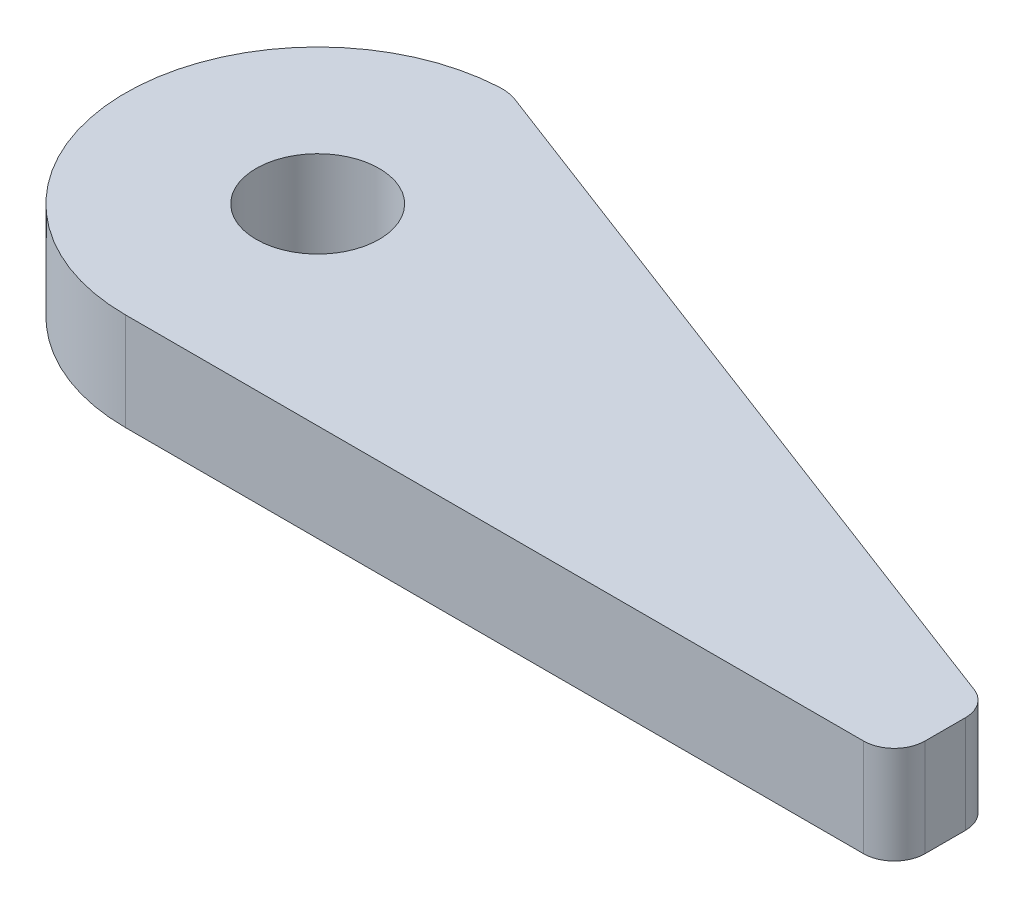
from build123d import *

# Parameters (mm, degrees)
SKETCH1_R           = 4
BOSS_EXTRUDE1_DEPTH = 6.35
FILLET1_R           = 2
FILLET2_R           = 3


with BuildPart() as part:
    # Sketch1 → Boss-Extrude1 (new body)
    with BuildSketch(Plane(origin=(0, 0, 0), x_dir=(1, 0, 0), z_dir=(0, 1, 0))):
        with BuildLine():
            Line((0, -12.5), (50, -12.5))
            Line((50, -12.5), (50, -6.5))
            Line((50, -6.5), (0, 12.5))
            ThreePointArc((0, 12.5), (-12.5, 0), (0, -12.5))
        make_face()
        with Locations(Location((0, 0, 0), (0, 0, 270))):
            Circle(SKETCH1_R, mode=Mode.SUBTRACT)
    extrude(amount=BOSS_EXTRUDE1_DEPTH)

    # Fillet1
    fillet1_edges = [part.edges().sort_by_distance(p)[0] for p in [
        (50, 3.175, 6.5),
        (50, 3.175, 12.5),
    ]]
    fillet(fillet1_edges, radius=FILLET1_R)

    # Fillet2
    fillet2_edges = [part.edges().sort_by_distance(p)[0] for p in [
        (0, 3.175, -12.5),
    ]]
    fillet(fillet2_edges, radius=FILLET2_R)


solid = part.part
